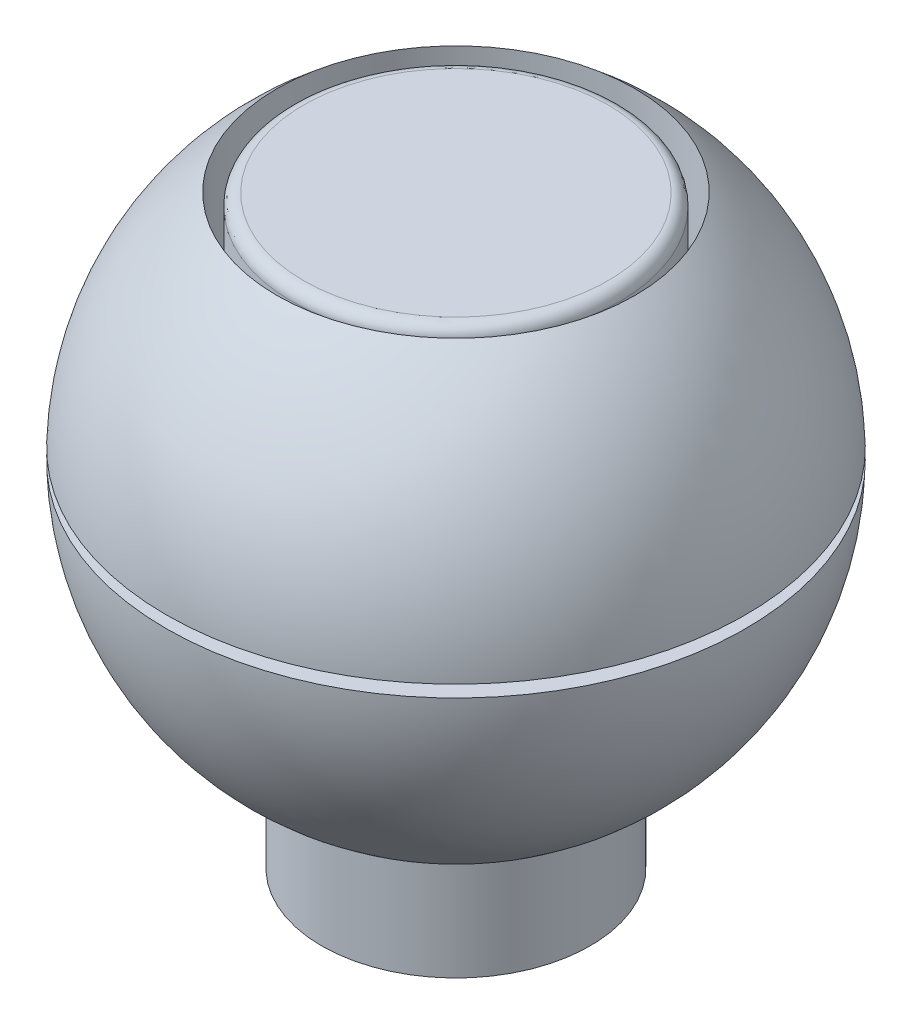
from build123d import *

# Parameters (mm, degrees)
CUT_EXTRUDE1_DEPTH      = 10
CUT_EXTRUDE1_DEPTH_BACK = 10
SKETCH2_R               = 1.6
SKETCH3_R               = 3
CUT_EXTRUDE2_DEPTH      = 10
SKETCH4_R               = 2.75
BOSS_EXTRUDE1_DEPTH     = 3
FILLET1_R               = 0.2
SKETCH5_R               = 2.25
SKETCH5_R_2             = 1.6
BOSS_EXTRUDE2_DEPTH     = 6
SKETCH6_R               = 6.07528897
CUT_EXTRUDE3_DEPTH      = 0.1


with BuildPart() as part:
    # Sketch1 → Revolve1 (revolve)
    with BuildSketch(Plane(origin=(0, 0, 0), x_dir=(1, 0, 0), z_dir=(0, 1, 0))):
        with BuildLine():
            Line((0, -4.85), (0, 4.85))
            ThreePointArc((0, 4.85), (4.85, 0), (0, -4.85))
        make_face()
    revolve(axis=Axis((0, 0, 4.85), (0, 0, -1)))

    # Sketch2 → Cut-Extrude1 (cut, two sides: drawn at the far end of the back side and taken through both)
    with BuildSketch(Plane(origin=(0, 0, 0), x_dir=(1, 0, 0), z_dir=(0, 1, 0)).offset(-CUT_EXTRUDE1_DEPTH_BACK)):
        Circle(SKETCH2_R)
    extrude(amount=CUT_EXTRUDE1_DEPTH + CUT_EXTRUDE1_DEPTH_BACK, mode=Mode.SUBTRACT)

    # Sketch3 → Cut-Extrude2 (cut)
    with BuildSketch(Plane(origin=(0, 0.8, 0), x_dir=(1, 0, 0), z_dir=(0, 1, 0))):
        Circle(SKETCH3_R)
    extrude(amount=CUT_EXTRUDE2_DEPTH, mode=Mode.SUBTRACT)

    # Sketch5 → Boss-Extrude2 (add)
    with BuildSketch(Plane(origin=(0, 0, 0), x_dir=(1, 0, 0), z_dir=(0, 1, 0))):
        Circle(SKETCH5_R)
        Circle(SKETCH5_R_2, mode=Mode.SUBTRACT)
    extrude(amount=-BOSS_EXTRUDE2_DEPTH)

    # Sketch6 → Cut-Extrude3 (cut, symmetric)
    with BuildSketch(Plane(origin=(0, 0, 0), x_dir=(1, 0, 0), z_dir=(0, 1, 0))):
        Circle(SKETCH6_R)
    extrude(amount=CUT_EXTRUDE3_DEPTH, both=True, mode=Mode.SUBTRACT)


with BuildPart() as body_2:
    # Sketch4 → Boss-Extrude1 (new body)
    with BuildSketch(Plane(origin=(0, 0.8, 0), x_dir=(1, 0, 0), z_dir=(0, 1, 0))):
        Circle(SKETCH4_R)
    extrude(amount=BOSS_EXTRUDE1_DEPTH)

    # Fillet1
    fillet1_edges = [body_2.edges().sort_by_distance(p)[0] for p in [
        (-2.75, 3.8, 0),
    ]]
    fillet(fillet1_edges, radius=FILLET1_R)


with BuildPart() as cut_extrude3_piece_1:
    # of the separate pieces the step leaves, piece 1, a body of its own (cut_extrude3_pieces)
    add(part.part.solids().sort_by_distance((0, -0.1, 4.848968963))[0])


with BuildPart() as cut_extrude3_piece_2:
    # of the separate pieces the step leaves, piece 2, a body of its own (cut_extrude3_pieces)
    add(part.part.solids().sort_by_distance((0, 0.1, 4.848968963))[0])


solid = Compound([body_2.part, cut_extrude3_piece_1.part, cut_extrude3_piece_2.part])
